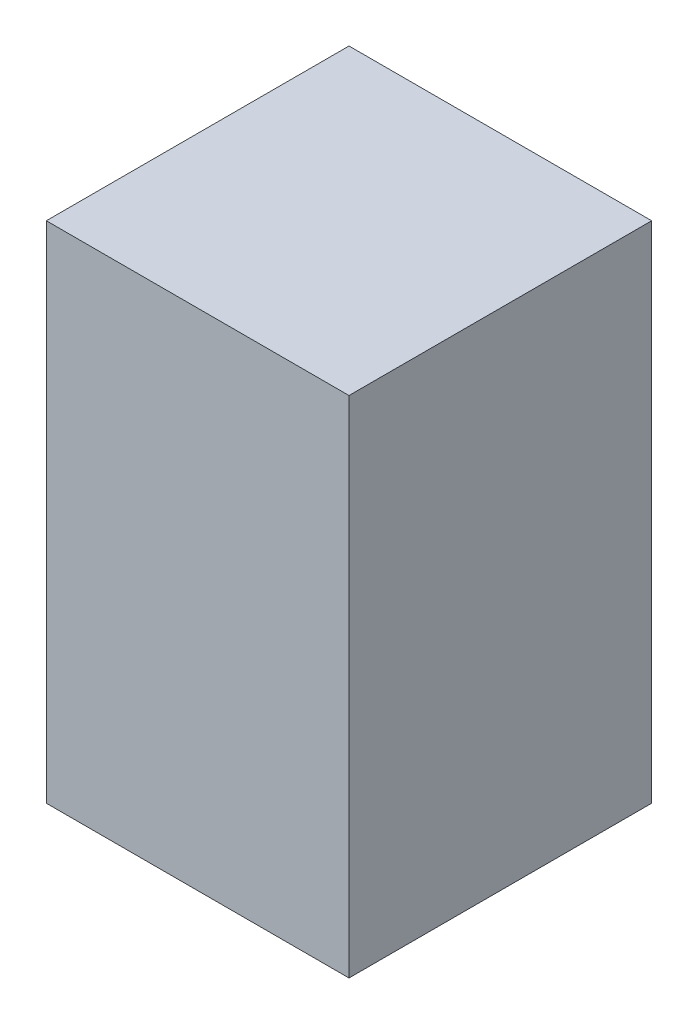
from build123d import *

# Parameters (mm, degrees)
SKETCH1_W           = 30
SKETCH1_H           = 50
BOSS_EXTRUDE1_DEPTH = 30


with BuildPart() as part:
    # Sketch1 → Boss-Extrude1 (new body)
    with BuildSketch(Plane.XY):
        Rectangle(SKETCH1_W, SKETCH1_H)
    extrude(amount=BOSS_EXTRUDE1_DEPTH)


solid = part.part
